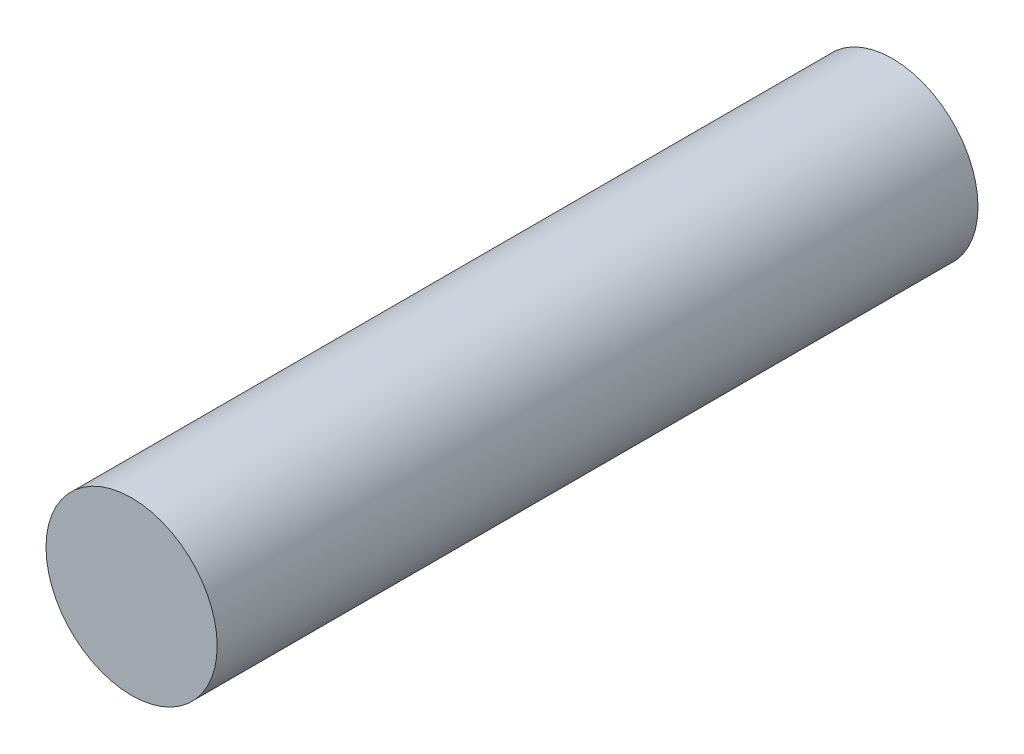
from build123d import *

# Parameters (mm, degrees)
SKETCH1_R           = 0.9
BOSS_EXTRUDE1_DEPTH = 8


with BuildPart() as part:
    # Sketch1 → Boss-Extrude1 (new body)
    with BuildSketch(Plane.XY):
        with Locations((-7.13, 4.83)):
            Circle(SKETCH1_R)
    extrude(amount=-BOSS_EXTRUDE1_DEPTH)


solid = part.part
